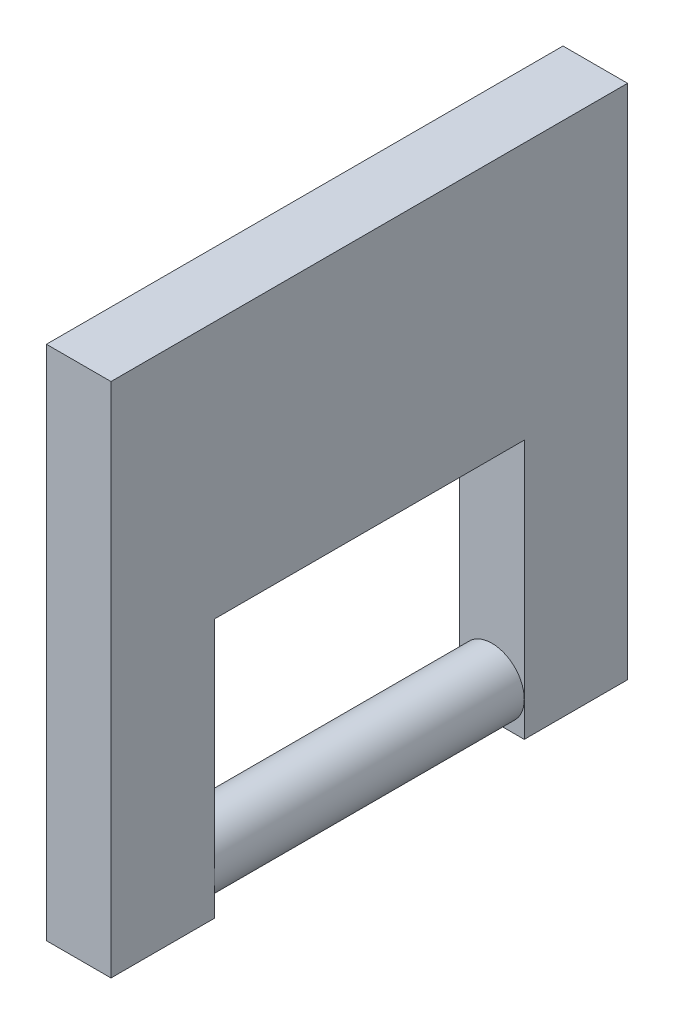
from build123d import *

# Parameters (mm, degrees)
SKETCH1_W           = 25.4
SKETCH1_H           = 25.4
BOSS_EXTRUDE1_DEPTH = 3.175
SKETCH2_W           = 15.24
SKETCH2_H           = 12.744579596
CUT_EXTRUDE1_DEPTH  = 74.44478714
SKETCH3_R           = 1.5875
BOSS_EXTRUDE4_DEPTH = 15.24


with BuildPart() as part:
    # Sketch1 → Boss-Extrude1 (new body)
    with BuildSketch(Plane(origin=(0, 0, 0), x_dir=(0, 0, -1), z_dir=(1, 0, 0))):
        with Locations((-53.44770318, -19.057479388)):
            Rectangle(SKETCH1_W, SKETCH1_H)
    extrude(amount=BOSS_EXTRUDE1_DEPTH)

    # Sketch2 → Cut-Extrude1 (cut, through all)
    with BuildSketch(Plane(origin=(3.175, 0, 0), x_dir=(0, 0, -1), z_dir=(1, 0, 0))):
        with Locations((-53.44770318, -25.38518959)):
            Rectangle(SKETCH2_W, SKETCH2_H)
    extrude(amount=-CUT_EXTRUDE1_DEPTH, mode=Mode.SUBTRACT)

    # Sketch3 → Boss-Extrude4 (add)
    with BuildSketch(Plane.XY.offset(45.82770318)):
        with Locations(Location((1.5875, -30.04486866, 0), (0, 0, 180))):
            Circle(SKETCH3_R)
    extrude(amount=BOSS_EXTRUDE4_DEPTH)


solid = part.part
